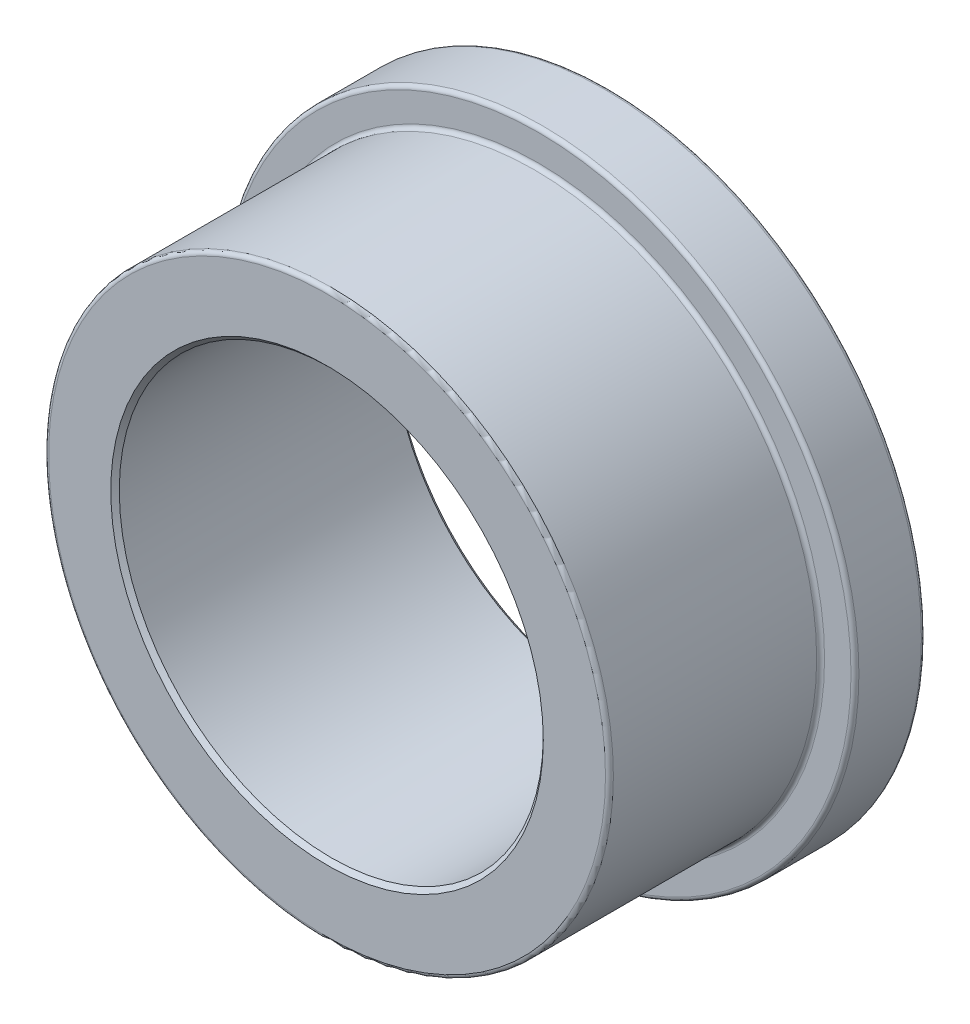
from build123d import *

# Parameters (mm, degrees)
SKETCH3_R           = 12.7381
SKETCH3_R_2         = 9.5631
BOSS_EXTRUDE1_DEPTH = 12.7
SKETCH4_R           = 14.2875
SKETCH4_R_2         = 12.7381
BOSS_EXTRUDE2_DEPTH = 3.175
CHAMFER1_SIZE       = 0.191262
FILLET1_R           = 0.1783334


with BuildPart() as part:
    # Sketch3 → Boss-Extrude1 (new body)
    with BuildSketch(Plane.XY):
        Circle(SKETCH3_R)
        Circle(SKETCH3_R_2, mode=Mode.SUBTRACT)
    extrude(amount=BOSS_EXTRUDE1_DEPTH)

    # Sketch4 → Boss-Extrude2 (add)
    with BuildSketch(Plane.XY):
        Circle(SKETCH4_R)
        Circle(SKETCH4_R_2, mode=Mode.SUBTRACT)
    extrude(amount=BOSS_EXTRUDE2_DEPTH)

    # Chamfer1
    chamfer1_edges = [part.edges().sort_by_distance(p)[0] for p in [
        (-9.5631, 0, 0),
        (-9.5631, 0, 12.7),
    ]]
    chamfer(chamfer1_edges, length=CHAMFER1_SIZE)

    # Fillet1
    fillet1_edges = [part.edges().sort_by_distance(p)[0] for p in [
        (-14.2875, 0, 3.175),
        (-14.2875, 0, 0),
        (-12.7381, 0, 3.175),
        (-12.7381, 0, 12.7),
    ]]
    fillet(fillet1_edges, radius=FILLET1_R)


solid = part.part
